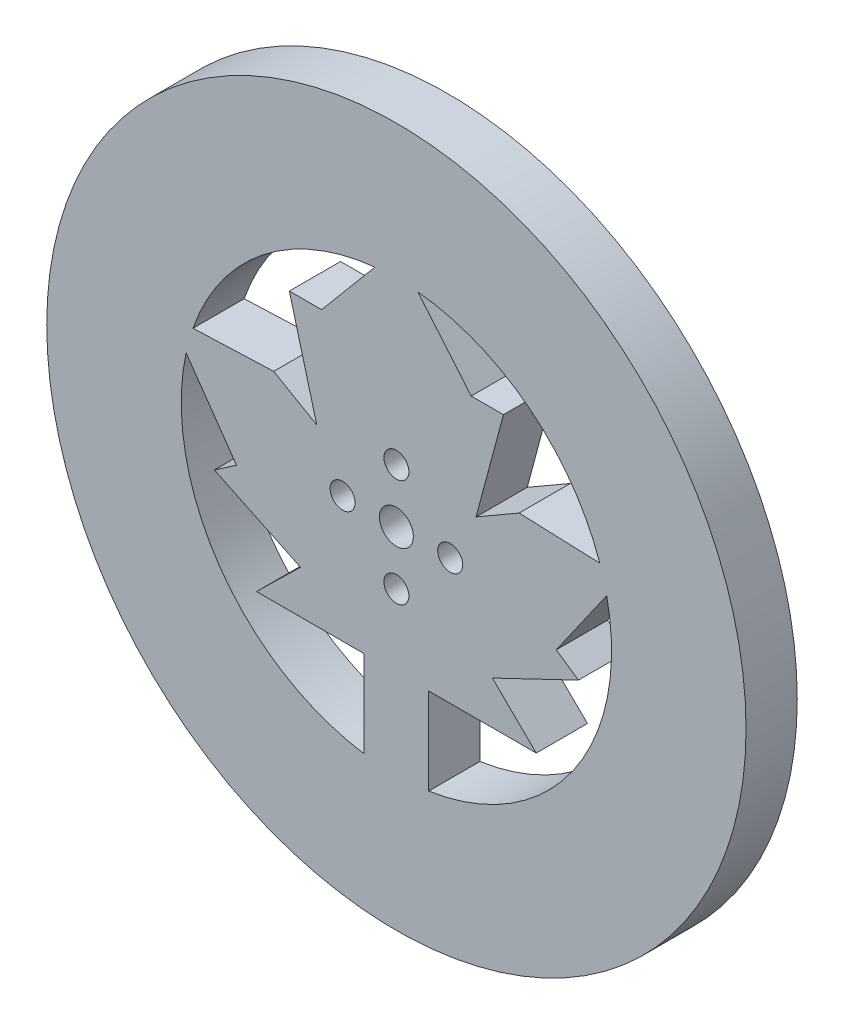
from build123d import *

# Parameters (mm, degrees)
SKETCH1_R           = 41.275
SKETCH1_R_2         = 1.4732
SKETCH1_R_3         = 2
BOSS_EXTRUDE1_DEPTH = 6.0452
CUT_EXTRUDE3_DEPTH  = 59.683862288


with BuildPart() as part:
    # Sketch1 → Boss-Extrude1 (new body)
    with BuildSketch(Plane.XY):
        Circle(SKETCH1_R)
        with Locations((-6.35, 0)):
            Circle(SKETCH1_R_2, mode=Mode.SUBTRACT)
        with Locations((0, 6.35)):
            Circle(SKETCH1_R_2, mode=Mode.SUBTRACT)
        with Locations((6.35, 0)):
            Circle(SKETCH1_R_2, mode=Mode.SUBTRACT)
        with Locations((0, -6.35)):
            Circle(SKETCH1_R_2, mode=Mode.SUBTRACT)
        Circle(SKETCH1_R_3, mode=Mode.SUBTRACT)
    extrude(amount=BOSS_EXTRUDE1_DEPTH)

    # Sketch2 → Cut-Extrude3 (cut, through all)
    with BuildSketch(Plane.XY.offset(6.0452)):
        with BuildLine():
            Line((8.827105782, 17.78), (2.54, 25.272680903))
            ThreePointArc((2.54, 25.272680903), (15.758317518, 19.920728626), (24.009298775, 8.289365013))
            Line((24.009298775, 8.289365013), (14.484298775, 8.647939367))
            Line((14.484298775, 8.647939367), (9.404298775, 5.715))
            Line((9.404298775, 5.715), (12.637105782, 17.78))
            Line((12.637105782, 17.78), (8.827105782, 17.78))
        make_face()
        with BuildLine():
            Line((18.868143133, -3.140634987), (24.826209076, 5.368365013))
            ThreePointArc((24.826209076, 5.368365013), (20.911260009, -14.418016674), (3.81, -25.112624315))
            Line((3.81, -25.112624315), (3.81, -14.877877919))
            Line((3.81, -14.877877919), (16.51, -14.877877919))
            Line((16.51, -14.877877919), (11.327081569, -9.797877919))
            Line((11.327081569, -9.797877919), (21.487081569, -4.935568543))
            Line((21.487081569, -4.935568543), (18.868143133, -3.140634987))
        make_face()
        with BuildLine():
            Line((-3.81, -14.877877919), (-3.81, -25.112624315))
            ThreePointArc((-3.81, -25.112624315), (-20.911260009, -14.418016674), (-24.826209076, 5.368365013))
            Line((-24.826209076, 5.368365013), (-18.868143133, -3.140634987))
            Line((-18.868143133, -3.140634987), (-21.487081569, -4.935568543))
            Line((-21.487081569, -4.935568543), (-11.327081569, -9.797877919))
            Line((-11.327081569, -9.797877919), (-16.51, -14.877877919))
            Line((-16.51, -14.877877919), (-3.81, -14.877877919))
        make_face()
        with BuildLine():
            Line((-14.484298775, 8.647939367), (-24.009298775, 8.289365013))
            ThreePointArc((-24.009298775, 8.289365013), (-15.758317518, 19.920728626), (-2.54, 25.272680903))
            Line((-2.54, 25.272680903), (-8.827105782, 17.78))
            Line((-8.827105782, 17.78), (-12.637105782, 17.78))
            Line((-12.637105782, 17.78), (-9.404298775, 5.715))
            Line((-9.404298775, 5.715), (-14.484298775, 8.647939367))
        make_face()
    extrude(amount=-CUT_EXTRUDE3_DEPTH, mode=Mode.SUBTRACT)


solid = part.part
